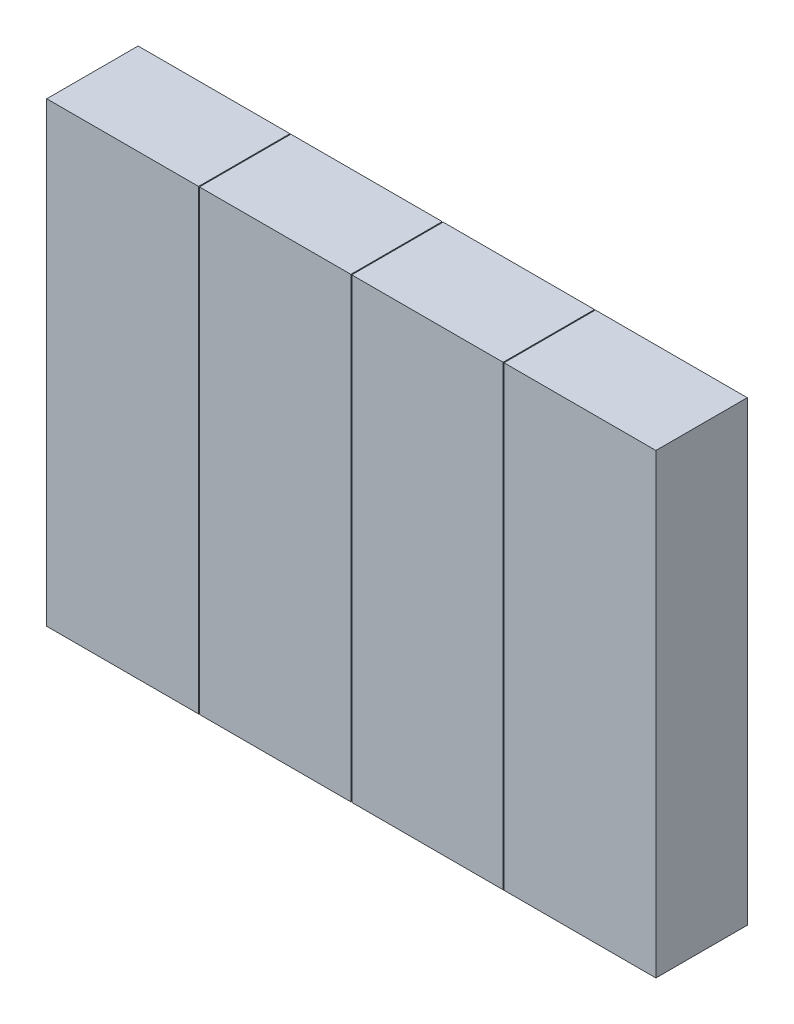
from build123d import *

# Parameters (mm, degrees)
SKETCH1_W           = 200
SKETCH1_H           = 150
BOSS_EXTRUDE1_DEPTH = 30
SKETCH2_W           = 0.3
SKETCH2_H           = 150
CUT_EXTRUDE1_DEPTH  = 331.551344976


with BuildPart() as part:
    # Sketch1 → Boss-Extrude1 (new body)
    with BuildSketch(Plane.XY):
        with Locations((-16.662906366, 232.821308462)):
            Rectangle(SKETCH1_W, SKETCH1_H)
    extrude(amount=BOSS_EXTRUDE1_DEPTH)

    # Sketch2 → Cut-Extrude1 (cut, through all)
    with BuildSketch(Plane.XY.offset(30)):
        with Locations((-66.662906366, 232.821308462)):
            Rectangle(SKETCH2_W, SKETCH2_H)
        with Locations((-16.662906366, 232.821308462)):
            Rectangle(SKETCH2_W, SKETCH2_H)
        with Locations((33.337093634, 232.821308462)):
            Rectangle(SKETCH2_W, SKETCH2_H)
    extrude(amount=-CUT_EXTRUDE1_DEPTH, mode=Mode.SUBTRACT)


with BuildPart() as cut_extrude1_piece_1:
    # of the separate pieces the step leaves, piece 1, a body of its own (cut_extrude1_pieces)
    add(part.part.solids().sort_by_distance((-66.812906366, 157.821308462, 0))[0])


with BuildPart() as cut_extrude1_piece_2:
    # of the separate pieces the step leaves, piece 2, a body of its own (cut_extrude1_pieces)
    add(part.part.solids().sort_by_distance((83.337093634, 157.821308462, 0))[0])


with BuildPart() as cut_extrude1_piece_3:
    # of the separate pieces the step leaves, piece 3, a body of its own (cut_extrude1_pieces)
    add(part.part.solids().sort_by_distance((-16.812906366, 157.821308462, 0))[0])


with BuildPart() as cut_extrude1_piece_4:
    # of the separate pieces the step leaves, piece 4, a body of its own (cut_extrude1_pieces)
    add(part.part.solids().sort_by_distance((33.187093634, 157.821308462, 0))[0])


solid = Compound([cut_extrude1_piece_1.part, cut_extrude1_piece_2.part, cut_extrude1_piece_3.part, cut_extrude1_piece_4.part])
